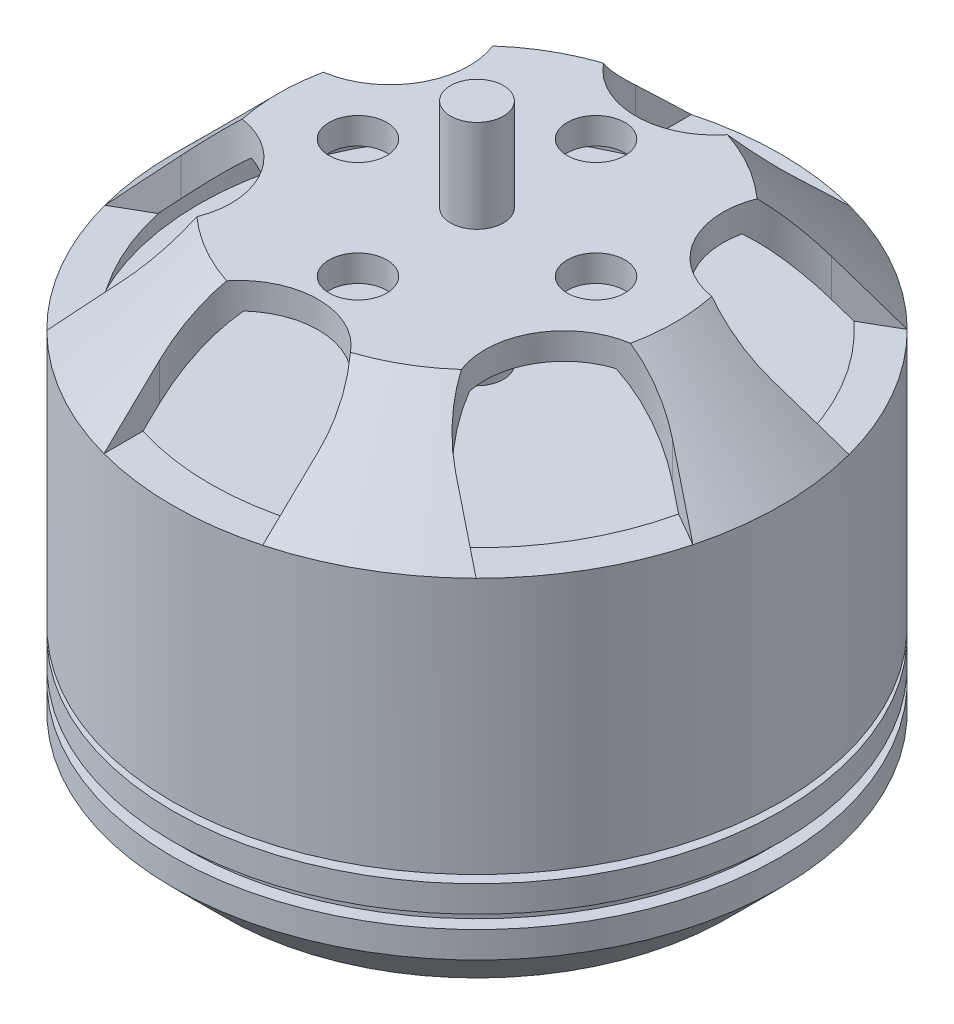
from build123d import *

# Parameters (mm, degrees)
SKETCH2_R          = 1.089830787
CUT_EXTRUDE1_DEPTH = 4
SKETCH3_R          = 1
CUT_EXTRUDE2_DEPTH = 3


with BuildPart() as part:
    # Sketch1 → Revolve2 (revolve)
    with BuildSketch(Plane.XY, mode=Mode.PRIVATE) as revolve2_sk:
        Polygon((0, 26.258738225), (0, 2.458738225), (1, 2.458738225), (1, 4.258738225), (9.5, 4.258738225), (11.5, 6.258738225), (11.5, 7.258738225), (11, 7.258738225), (11, 7.758738225), (11.5, 7.758738225), (11.5, 8.758738225), (9.5, 8.758738225), (9.5, 9.058738225), (11.5, 9.058738225), (11.5, 18.758738225), (7.5, 22.758738225), (1, 22.758738225), (1, 26.258738225), align=None)
        Polygon((1, 20.758738225), (2, 20.758738225), (2, 21.758738225), (7.085786438, 21.758738225), (10.5, 18.344524662), (10.5, 17.637121488), (1, 17.637121488), align=None, mode=Mode.SUBTRACT)
    revolve(revolve2_sk.sketch.rotate(Axis((0, 26.258738225, 0), (0, -1, 0)), 180), axis=Axis((0, 26.258738225, 0), (0, -1, 0)))

    # Sketch2 → Cut-Extrude1 (cut)
    with BuildSketch(Plane(origin=(0, 22.758738225, 0), x_dir=(1, 0, 0), z_dir=(0, 1, 0))):
        with Locations(Location((-4.5, 0, 0), (0, 0, 180))):
            Circle(SKETCH2_R)
        with Locations(Location((0, -4.5, 0), (0, 0, 180))):
            Circle(SKETCH2_R)
        with Locations(Location((0, 4.5, 0), (0, 0, 180))):
            Circle(SKETCH2_R)
        with Locations(Location((4.5, 0, 0), (0, 0, 180))):
            Circle(SKETCH2_R)
        with BuildLine():
            Line((-3, 9), (-3, 15.89))
            Line((-3, 15.89), (3, 15.89))
            Line((3, 15.89), (3, 9))
            ThreePointArc((3, 9), (0, 6), (-3, 9))
        make_face()
        with BuildLine():
            Line((9.294228634, 1.901923789), (15.261143666, 5.346923789))
            Line((15.261143666, 5.346923789), (12.261143666, 10.543076211))
            Line((12.261143666, 10.543076211), (6.294228634, 7.098076211))
            ThreePointArc((6.294228634, 7.098076211), (5.196152423, 3), (9.294228634, 1.901923789))
        make_face()
        with BuildLine():
            Line((6.294228634, -7.098076211), (12.261143666, -10.543076211))
            Line((12.261143666, -10.543076211), (15.261143666, -5.346923789))
            Line((15.261143666, -5.346923789), (9.294228634, -1.901923789))
            ThreePointArc((9.294228634, -1.901923789), (5.196152423, -3), (6.294228634, -7.098076211))
        make_face()
        with BuildLine():
            Line((-3, -9), (-3, -15.89))
            Line((-3, -15.89), (3, -15.89))
            Line((3, -15.89), (3, -9))
            ThreePointArc((3, -9), (0, -6), (-3, -9))
        make_face()
        with BuildLine():
            Line((-9.294228634, -1.901923789), (-15.261143666, -5.346923789))
            Line((-15.261143666, -5.346923789), (-12.261143666, -10.543076211))
            Line((-12.261143666, -10.543076211), (-6.294228634, -7.098076211))
            ThreePointArc((-6.294228634, -7.098076211), (-5.196152423, -3), (-9.294228634, -1.901923789))
        make_face()
        with BuildLine():
            Line((-6.294228634, 7.098076211), (-12.261143666, 10.543076211))
            Line((-12.261143666, 10.543076211), (-15.261143666, 5.346923789))
            Line((-15.261143666, 5.346923789), (-9.294228634, 1.901923789))
            ThreePointArc((-9.294228634, 1.901923789), (-5.196152423, 3), (-6.294228634, 7.098076211))
        make_face()
    extrude(amount=-CUT_EXTRUDE1_DEPTH, mode=Mode.SUBTRACT)

    # Sketch3 → Cut-Extrude2 (cut)
    with BuildSketch(Plane.XZ.offset(-4.258738225)):
        with Locations((0, 6)):
            Circle(SKETCH3_R)
        with Locations((0, -6)):
            Circle(SKETCH3_R)
        with Locations((-8, 0)):
            Circle(SKETCH3_R)
        with Locations((8, 0)):
            Circle(SKETCH3_R)
    extrude(amount=-CUT_EXTRUDE2_DEPTH, mode=Mode.SUBTRACT)


solid = part.part
